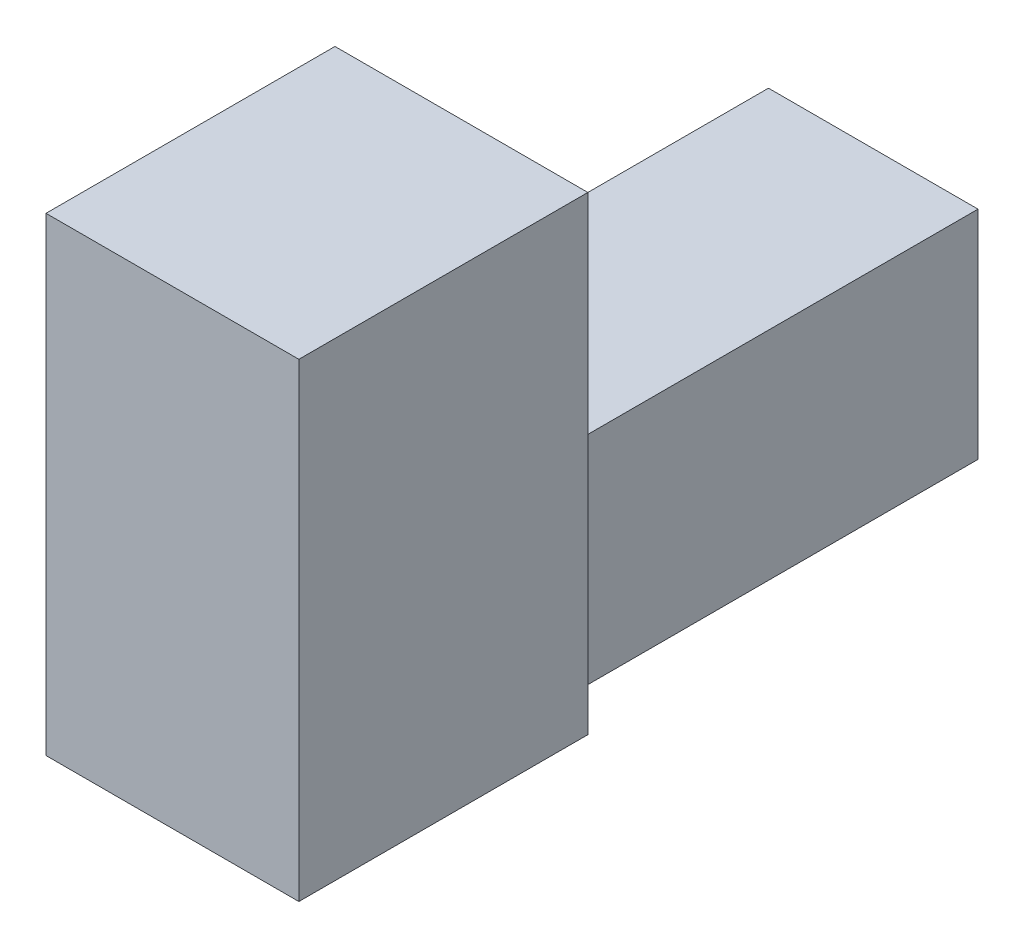
from build123d import *

# Parameters (mm, degrees)
SKETCH1_W           = 100
SKETCH1_H           = 65
BOSS_EXTRUDE1_DEPTH = 35
SKETCH4_W           = 60
SKETCH4_H           = 30
CUT_EXTRUDE1_DEPTH  = 6
SKETCH5_W           = 60
SKETCH5_H           = 35
CUT_EXTRUDE2_DEPTH  = 70.14658343


with BuildPart() as part:
    # Sketch1 → Boss-Extrude1 (new body)
    with BuildSketch(Plane(origin=(0, 0, 0), x_dir=(0, 0, -1), z_dir=(1, 0, 0))):
        Rectangle(SKETCH1_W, SKETCH1_H)
    extrude(amount=BOSS_EXTRUDE1_DEPTH)

    # Sketch4 → Cut-Extrude1 (cut)
    with BuildSketch(Plane(origin=(35, 0, 0), x_dir=(0, 0, -1), z_dir=(1, 0, 0))):
        with Locations((20, -17.5)):
            Rectangle(SKETCH4_W, SKETCH4_H)
    extrude(amount=-CUT_EXTRUDE1_DEPTH, mode=Mode.SUBTRACT)

    # Sketch5 → Cut-Extrude2 (cut, through all)
    with BuildSketch(Plane(origin=(35, 0, 0), x_dir=(0, 0, -1), z_dir=(1, 0, 0))):
        with Locations((20, 15)):
            Rectangle(SKETCH5_W, SKETCH5_H)
    extrude(amount=-CUT_EXTRUDE2_DEPTH, mode=Mode.SUBTRACT)


solid = part.part
